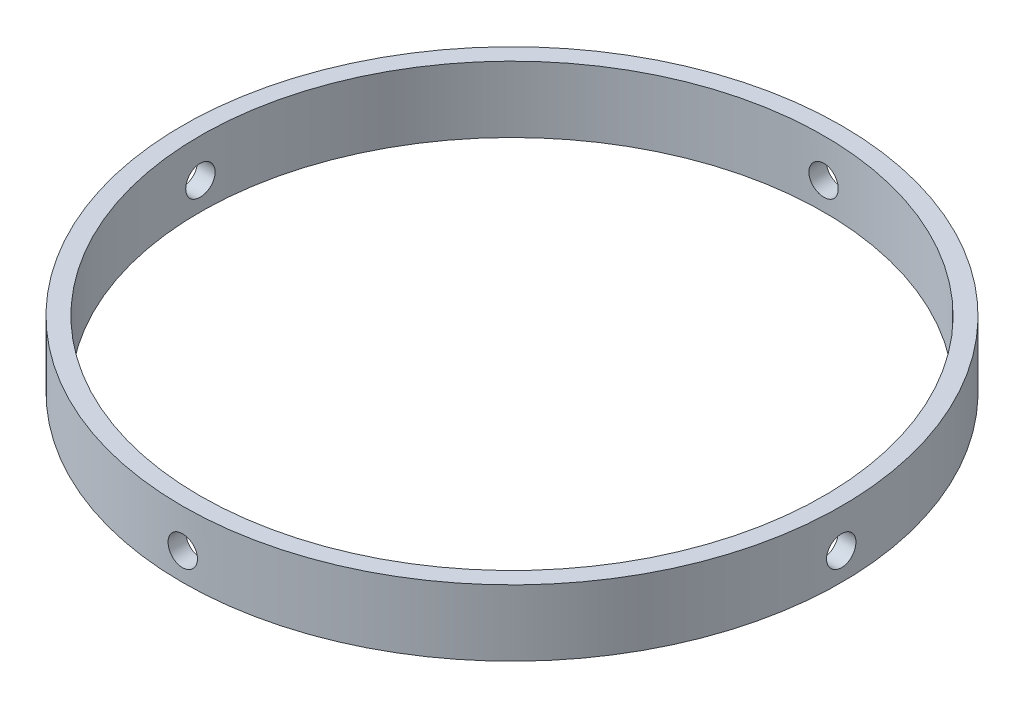
from build123d import *

# Parameters (mm, degrees)
SKETCH1_R           = 37.973
SKETCH1_R_2         = 35.941
BOSS_EXTRUDE1_DEPTH = 7.62
SKETCH2_R           = 1.692869147
CUT_EXTRUDE1_DEPTH  = 86.62
CIRPATTERN1_COUNT   = 4


with BuildPart() as part:
    # Sketch1 → Boss-Extrude1 (new body)
    with BuildSketch(Plane(origin=(0, 0, 0), x_dir=(1, 0, 0), z_dir=(0, 1, 0))):
        with Locations(Location((0, 0, 0), (0, 0, 90))):
            Circle(SKETCH1_R)
        with Locations(Location((0, 0, 0), (0, 0, 90))):
            Circle(SKETCH1_R_2, mode=Mode.SUBTRACT)
    extrude(amount=BOSS_EXTRUDE1_DEPTH)

    # Sketch2 → Cut-Extrude1 (cut)
    with BuildSketch(Plane.XY):
        with Locations(Location((0, 3.171011831, 0), (0, 0, 180))):
            Circle(SKETCH2_R)
    cut_extrude1 = extrude(amount=CUT_EXTRUDE1_DEPTH, mode=Mode.SUBTRACT)

    # CirPattern1: Cut-Extrude1 ×4 about axis
    cirpattern1_axis = Axis((0, 0, 0), (0, -1, 0))
    for i in range(1, CIRPATTERN1_COUNT):
        add(cut_extrude1.rotate(cirpattern1_axis, i * 360 / CIRPATTERN1_COUNT), mode=Mode.SUBTRACT)


solid = part.part
